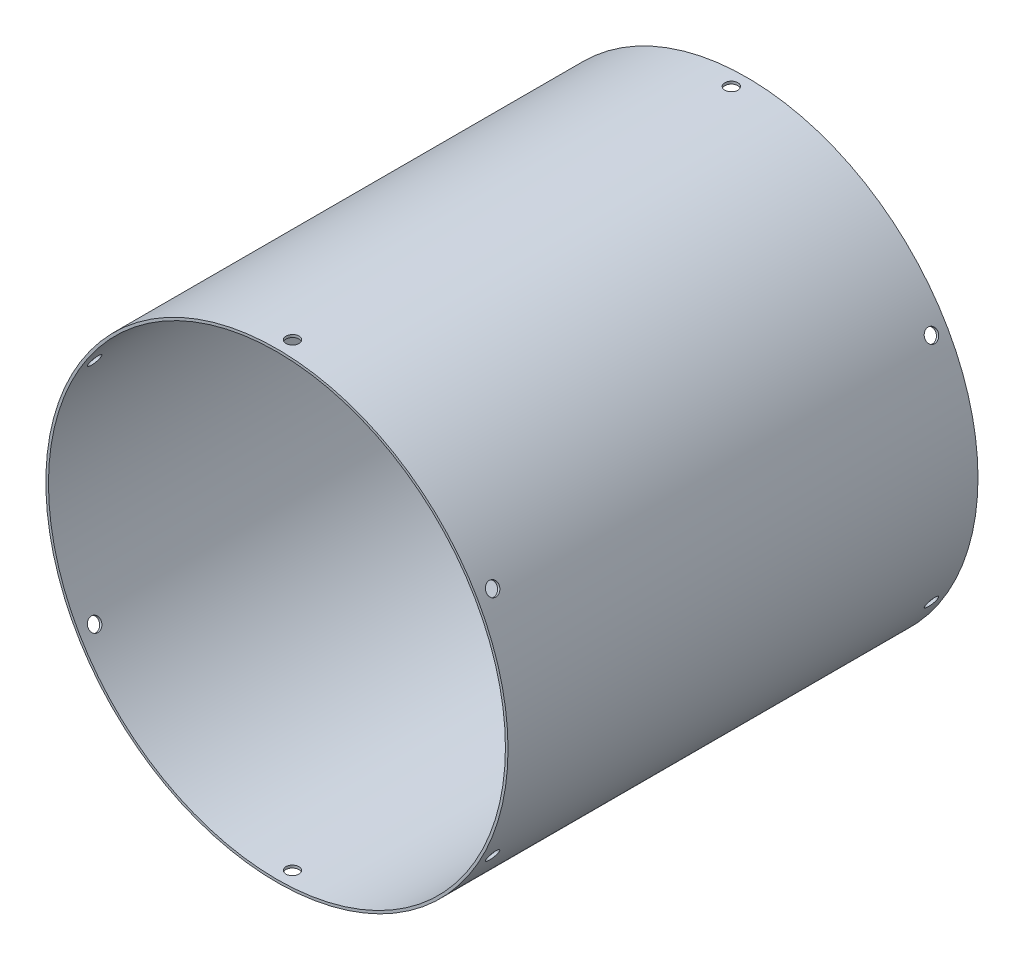
from build123d import *

# Parameters (mm, degrees)
SKETCH1_R           = 44.5
SKETCH1_R_2         = 44
BOSS_EXTRUDE1_DEPTH = 90.5
SKETCH2_R           = 1.25
CUT_EXTRUDE1_DEPTH  = 111.230440442
CIRPATTERN1_COUNT   = 6
SKETCH3_R           = 3.5
CUT_EXTRUDE2_DEPTH  = 111.230440607
CIRPATTERN2_COUNT   = 2
CIRPATTERN2_ANGLE   = 120


with BuildPart() as part:
    # Sketch1 → Boss-Extrude1 (new body)
    with BuildSketch(Plane.XY):
        Circle(SKETCH1_R)
        Circle(SKETCH1_R_2, mode=Mode.SUBTRACT)
    extrude(amount=BOSS_EXTRUDE1_DEPTH)

    # Sketch2 → Cut-Extrude1 (cut, through all)
    with BuildSketch(Plane(origin=(0, 0, 0), x_dir=(1, 0, 0), z_dir=(0, 1, 0))):
        with Locations(Location((0, -3, 0), (0, 0, 270))):
            Circle(SKETCH2_R)
        with Locations(Location((0, -87.5, 0), (0, 0, 270))):
            Circle(SKETCH2_R)
    cut_extrude1 = extrude(amount=-CUT_EXTRUDE1_DEPTH, mode=Mode.SUBTRACT)

    # CirPattern1: Cut-Extrude1 ×6 about axis
    cirpattern1_axis = Axis((0, 0, 90.5), (0, 0, -1))
    for i in range(1, CIRPATTERN1_COUNT):
        add(cut_extrude1.rotate(cirpattern1_axis, i * 360 / CIRPATTERN1_COUNT), mode=Mode.SUBTRACT)

    # Sketch3 → Cut-Extrude2 (cut, through all)
    with BuildSketch(Plane(origin=(0, 0, 0), x_dir=(0, 0, -1), z_dir=(0.9575713608048143, -0.28819626813409, 0))):
        with Locations(Location((-42, 0, 0), (0, 0, 90))):
            Circle(SKETCH3_R)
    cut_extrude2 = extrude(amount=-CUT_EXTRUDE2_DEPTH, mode=Mode.SUBTRACT)

    # CirPattern2: Cut-Extrude2 ×2 about axis
    cirpattern2_axis = Axis((0, 0, 90.5), (0, 0, 1))
    for i in range(1, CIRPATTERN2_COUNT):
        add(cut_extrude2.rotate(cirpattern2_axis, i * CIRPATTERN2_ANGLE / (CIRPATTERN2_COUNT - 1)), mode=Mode.SUBTRACT)


solid = part.part
